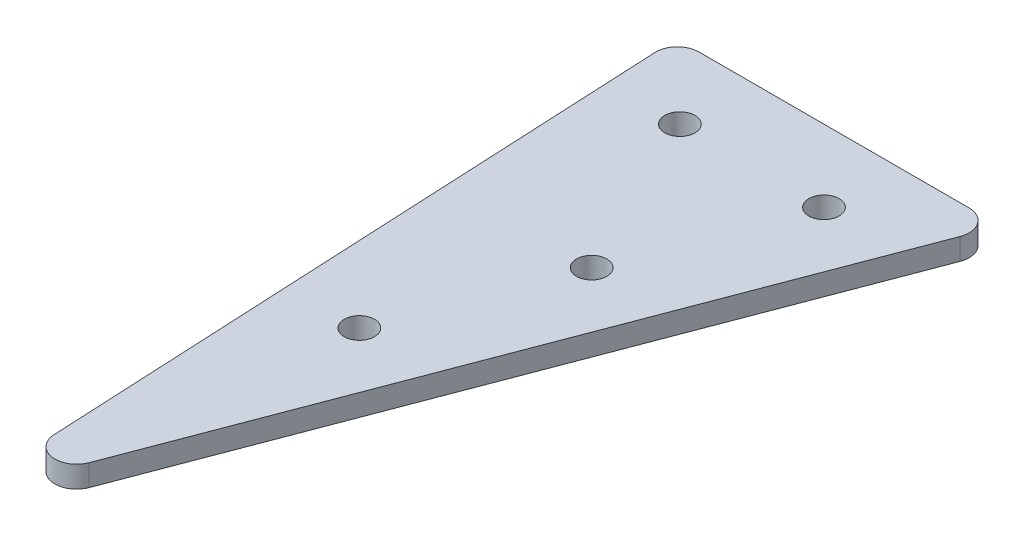
from build123d import *

# Parameters (mm, degrees)
SKETCH_1_R      = 2.1
EXTRUDE_1_DEPTH = 3
FILLET_1_R      = 3


with BuildPart() as part:
    # 草图1 → 凸台-拉伸1 (new body)
    with BuildSketch(Plane(origin=(0, 0, 0), x_dir=(1, 0, 0), z_dir=(0, 1, 0))):
        Polygon((-30.495345075, 10), (14.490413826, 10), (-25.409775328, -95.148540432), align=None)
        with Locations(Location((0, 0, 0), (0, 0, 270))):
            Circle(SKETCH_1_R, mode=Mode.SUBTRACT)
        with Locations(Location((-20, 0, 0), (0, 0, 270))):
            Circle(SKETCH_1_R, mode=Mode.SUBTRACT)
        with Locations(Location((-8.869515627, -23.373739379, 0), (0, 0, 270))):
            Circle(SKETCH_1_R, mode=Mode.SUBTRACT)
        with Locations(Location((-17.739031253, -46.747478758, 0), (0, 0, 270))):
            Circle(SKETCH_1_R, mode=Mode.SUBTRACT)
    extrude(amount=EXTRUDE_1_DEPTH)

    # 圆角1
    fillet_1_edges = [part.edges().sort_by_distance(p)[0] for p in [
        (-30.495345075, 1.5, -10),
        (14.490413826, 1.5, -10),
        (-25.409775328, 1.5, 95.148540432),
    ]]
    fillet(fillet_1_edges, radius=FILLET_1_R)


solid = part.part
